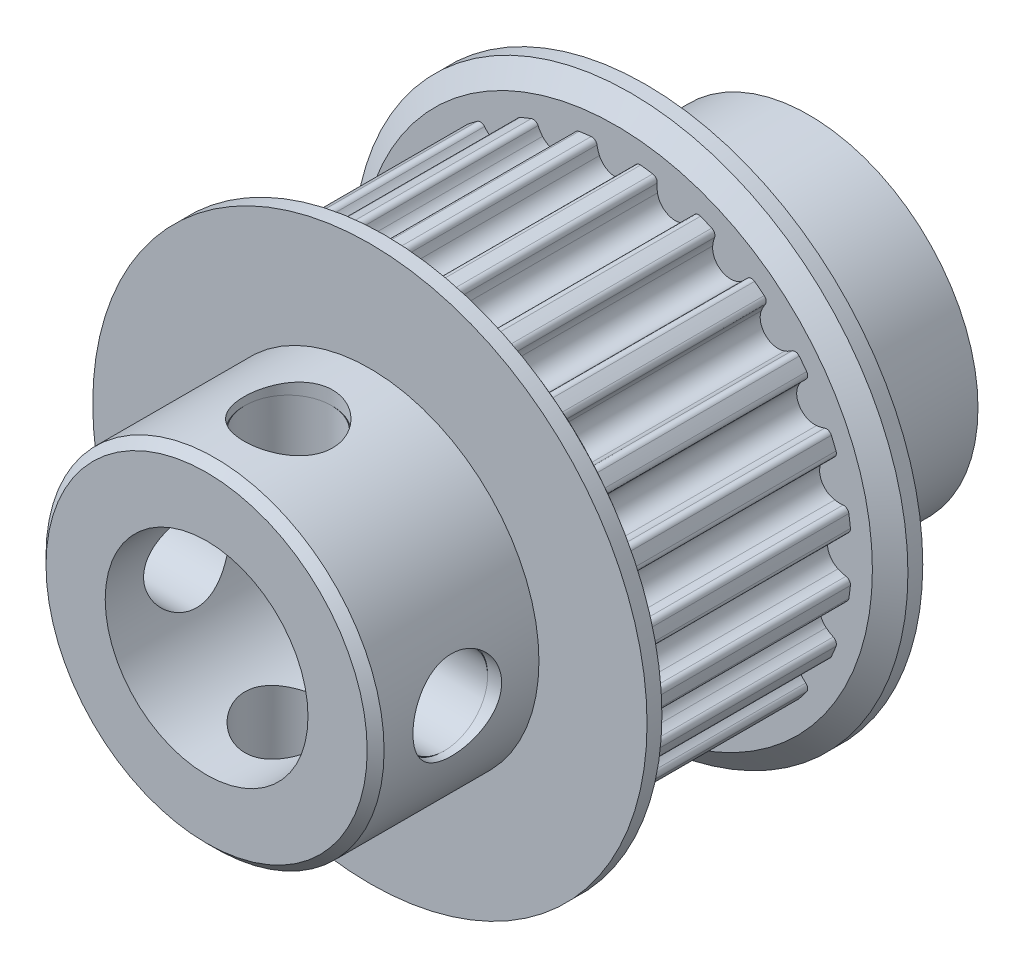
from build123d import *

# Parameters (mm, degrees)
CUT_EXTRUDE1_START      = 1.245
CUT_EXTRUDE1_DEPTH      = 10.16
CIRPATTERN1_COUNT       = 24
SKETCH4_R               = 2.0828
CUT_EXTRUDE2_DEPTH      = 22.099922097
CUT_EXTRUDE3_DEPTH      = 1.5621
CIRPATTERN2_COUNT       = 2
CIRPATTERN2_ANGLE       = 90
CHAMFER1_SIZE           = 0.397
SKETCH8_R               = 7.94004
BOSS_EXTRUDE1_DEPTH     = 7.6708
CUT_EXTRUDE6_DEPTH      = 34.75322173
CUT_EXTRUDE6_DEPTH_BACK = 34.75322173
SKETCH9_R               = 4.7625
CUT_EXTRUDE7_DEPTH      = 31.338165836
CUT_EXTRUDE7_DEPTH_BACK = 31.338165836
SKETCH10_R              = 2.032
SKETCH11_R              = 2.032
CUT_EXTRUDE8_DEPTH      = 20.828


with BuildPart() as part:
    # Sketch2 → Revolve1 (revolve)
    with BuildSketch(Plane(origin=(0, 0, 0), x_dir=(0, 0, -1), z_dir=(1, 0, 0)), mode=Mode.PRIVATE) as revolve1_sk:
        Polygon((-10.31, 3.175), (10.31, 3.175), (10.31, 13.0175), (9.6125, 13.0175), (8.915, 12.046), (8.915, 11.0745), (-1.245, 11.0745), (-1.245, 12.046), (-1.9425, 13.0175), (-2.64, 13.0175), (-2.64, 7.94), (-10.31, 7.94), align=None)
    revolve(revolve1_sk.sketch.rotate(Axis((0, 0, 10.31), (0, 0, -1)), 90), axis=Axis((0, 0, 10.31), (0, 0, -1)))

    # Sketch3 → Cut-Extrude1 (cut)
    with BuildSketch(Plane.XY.offset(CUT_EXTRUDE1_START)):
        with BuildLine():
            Line((3.499719537, 13.0175), (-3.499719537, 13.0175))
            Line((-3.499719537, 13.0175), (-2.875251976, 10.694740592))
            ThreePointArc((-2.875251976, 10.694740592), (-2.024483834, 10.887883883), (-1.161152096, 11.01345886))
            ThreePointArc((-1.161152096, 11.01345886), (-0.983914058, 10.96406339), (-0.88847938, 10.806756502))
            ThreePointArc((-0.88847938, 10.806756502), (-0.843250935, 10.616137701), (-0.773880597, 10.432919538))
            ThreePointArc((-0.773880597, 10.432919538), (0, 9.9345), (0.773880597, 10.432919538))
            ThreePointArc((0.773880597, 10.432919538), (0.843250935, 10.616137701), (0.88847938, 10.806756502))
            ThreePointArc((0.88847938, 10.806756502), (0.983914058, 10.96406339), (1.161152096, 11.01345886))
            ThreePointArc((1.161152096, 11.01345886), (2.024483834, 10.887883883), (2.875251976, 10.694740592))
            Line((2.875251976, 10.694740592), (3.499719537, 13.0175))
        make_face()
    cut_extrude1 = extrude(amount=-CUT_EXTRUDE1_DEPTH, mode=Mode.SUBTRACT)

    # CirPattern1: Cut-Extrude1 ×24 about axis
    cirpattern1_axis = Axis((0, 0, 0), (0, 0, 1))
    for i in range(1, CIRPATTERN1_COUNT):
        add(cut_extrude1.rotate(cirpattern1_axis, i * 360 / CIRPATTERN1_COUNT), mode=Mode.SUBTRACT)

    # Sketch4 → Cut-Extrude2 (cut, through all)
    with BuildSketch(Plane(origin=(0, 0, 0), x_dir=(0, -1, 0), z_dir=(1, 0, 0))):
        with Locations(Location((0, -6.475, 0), (0, 0, 270))):
            Circle(SKETCH4_R)
    cut_extrude2 = extrude(amount=CUT_EXTRUDE2_DEPTH, mode=Mode.SUBTRACT)

    # Sketch5 → Revolve2 (revolve)
    with BuildSketch(Plane.XY.offset(6.475)):
        Polygon((3.175, -1.7018), (3.175, 0), (7.66195433, 0), (7.66195433, -1.7018), (7.28095433, -2.0828), (3.556, -2.0828), align=None)
    revolve2 = revolve(axis=Axis((3.175, 0, 6.475), (1, 0, 0)))

    # Sketch6 → Cut-Extrude3 (cut)
    with BuildSketch(Plane(origin=(7.66195433, 5.384140679, 0), x_dir=(0, -1, 0), z_dir=(-1, 0, 0))):
        Polygon((5.384140679, 7.677505141), (4.342740679, 7.07625257), (4.342740679, 5.87374743), (5.384140679, 5.272494859), (6.425540679, 5.87374743), (6.425540679, 7.07625257), align=None)
    cut_extrude3 = extrude(amount=CUT_EXTRUDE3_DEPTH, mode=Mode.SUBTRACT)

    # CirPattern2: Cut-Extrude2, Revolve2, Cut-Extrude3 ×2 about axis
    cirpattern2_axis = Axis((0, 0, 0), (0, 0, 1))
    add([cut_extrude2.rotate(cirpattern2_axis, i * CIRPATTERN2_ANGLE / (CIRPATTERN2_COUNT - 1)) for i in range(1, CIRPATTERN2_COUNT)], mode=Mode.SUBTRACT)
    add([revolve2.rotate(cirpattern2_axis, i * CIRPATTERN2_ANGLE / (CIRPATTERN2_COUNT - 1)) for i in range(1, CIRPATTERN2_COUNT)])
    add([cut_extrude3.rotate(cirpattern2_axis, i * CIRPATTERN2_ANGLE / (CIRPATTERN2_COUNT - 1)) for i in range(1, CIRPATTERN2_COUNT)], mode=Mode.SUBTRACT)

    # Chamfer1
    chamfer1_edges = [part.edges().sort_by_distance(p)[0] for p in [
        (-7.94, 0, 10.31),
        (-3.175, 0, 10.31),
    ]]
    chamfer(chamfer1_edges, length=CHAMFER1_SIZE)

    # Sketch8 → Boss-Extrude1 (add)
    with BuildSketch(Plane(origin=(0, 0, -10.31), x_dir=(-1, 0, 0), z_dir=(0, 0, -1))):
        with Locations(Location((0, 0, 0), (0, 0, 180))):
            Circle(SKETCH8_R)
    extrude(amount=BOSS_EXTRUDE1_DEPTH)

    # Sketch9 → Cut-Extrude6 (cut, two sides: drawn at the far end of the back side and taken through both)
    with BuildSketch(Plane.XY.offset(10.31).offset(-CUT_EXTRUDE6_DEPTH_BACK)):
        Circle(SKETCH9_R)
    extrude(amount=CUT_EXTRUDE6_DEPTH + CUT_EXTRUDE6_DEPTH_BACK, mode=Mode.SUBTRACT)

    # Sketch10 → Cut-Extrude7 (cut, two sides: drawn at the far end of the back side and taken through both)
    with BuildSketch(Plane(origin=(7.66195433, 0, 0), x_dir=(0, 0, -1), z_dir=(1, 0, 0)).offset(-CUT_EXTRUDE7_DEPTH_BACK)):
        with Locations(Location((-6.475, 0, 0), (0, 0, 90))):
            Circle(SKETCH10_R)
    extrude(amount=CUT_EXTRUDE7_DEPTH + CUT_EXTRUDE7_DEPTH_BACK, mode=Mode.SUBTRACT)

    # Sketch11 → Cut-Extrude8 (cut)
    with BuildSketch(Plane(origin=(0, 7.66195433, 0), x_dir=(1, 0, 0), z_dir=(0, 1, 0))):
        with Locations(Location((0, -6.475, 0), (0, 0, 180))):
            Circle(SKETCH11_R)
    extrude(amount=-CUT_EXTRUDE8_DEPTH, mode=Mode.SUBTRACT)


solid = part.part
